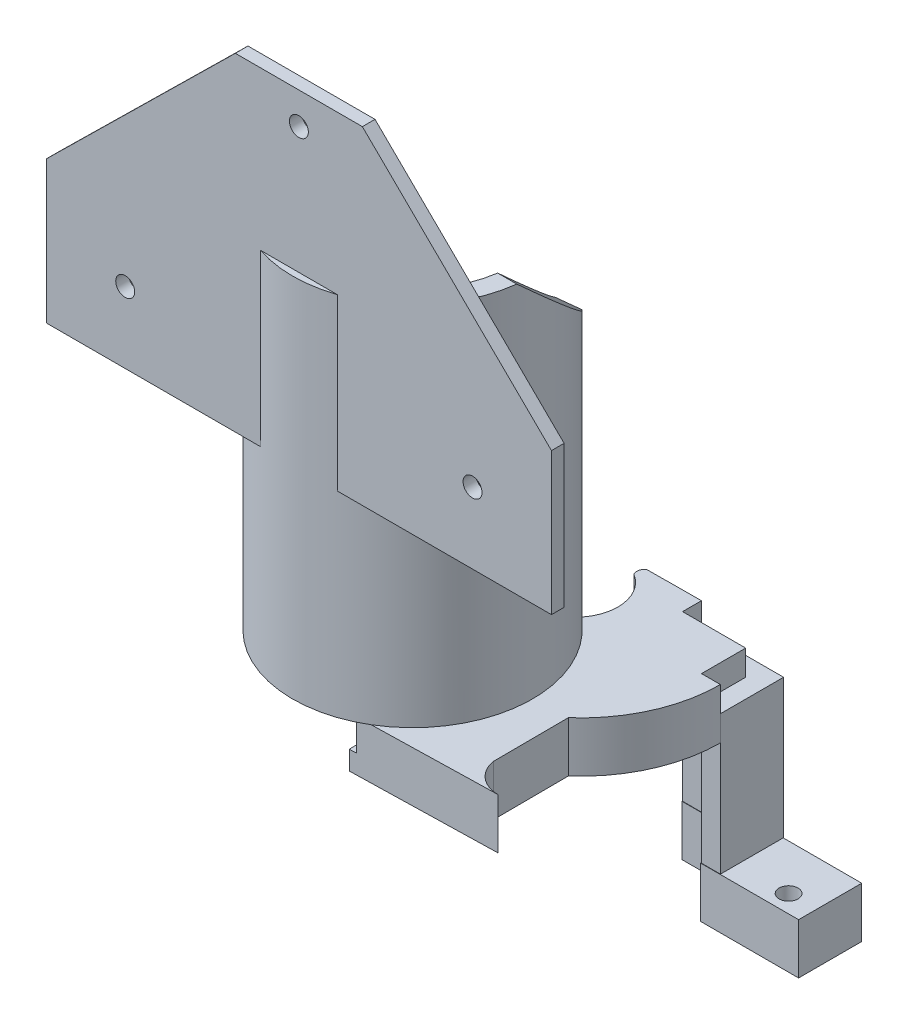
from build123d import *

# Parameters (mm, degrees)
BOSS_EXTRUDE1_DEPTH      = 53
BOSS_EXTRUDE1_DEPTH_BACK = 5
SKETCH1_R                = 19
SKETCH2_R                = 16
CUT_EXTRUDE1_DEPTH       = 22
SKETCH3_W                = 25
SKETCH3_H                = 20
CUT_EXTRUDE2_DEPTH       = 108
CUT_EXTRUDE3_DEPTH       = 108
CUT_EXTRUDE3_DEPTH_BACK  = 108
BOSS_EXTRUDE2_DEPTH      = 2
SKETCH10_R               = 1.5
CUT_EXTRUDE4_DEPTH       = 16
BOSS_EXTRUDE3_DEPTH      = 8
BOSS_EXTRUDE5_DEPTH      = 18
BOSS_EXTRUDE5_DEPTH_BACK = 4
SKETCH13_R               = 1.500172947
BOSS_EXTRUDE6_DEPTH      = 8
SKETCH16_R               = 18
CUT_EXTRUDE5_DEPTH       = 41


with BuildPart() as part:
    # Sketch1 → Boss-Extrude1 (new, two sides: drawn at the far end of the back side and taken through both)
    with BuildSketch(Plane(origin=(0, 0, 0), x_dir=(1, 0, 0), z_dir=(0, 1, 0)).offset(-BOSS_EXTRUDE1_DEPTH_BACK)):
        with Locations(Location((0, 0, 0), (0, 0, 270))):
            Circle(SKETCH1_R)
    extrude(amount=BOSS_EXTRUDE1_DEPTH + BOSS_EXTRUDE1_DEPTH_BACK)

    # Sketch2 → Cut-Extrude1 (cut)
    with BuildSketch(Plane(origin=(0, 53, 0), x_dir=(1, 0, 0), z_dir=(0, 1, 0))):
        with Locations(Location((0, 0, 0), (0, 0, 270))):
            Circle(SKETCH2_R)
    extrude(amount=-CUT_EXTRUDE1_DEPTH, mode=Mode.SUBTRACT)

    # Sketch3 → Cut-Extrude2 (cut)
    with BuildSketch(Plane(origin=(0, 53, 0), x_dir=(1, 0, 0), z_dir=(0, 1, 0))):
        with Locations((0, 16)):
            Rectangle(SKETCH3_W, SKETCH3_H)
    extrude(amount=-CUT_EXTRUDE2_DEPTH, mode=Mode.SUBTRACT)

    # Sketch7 → Cut-Extrude3 (cut, two sides: drawn at the far end of the back side and taken through both)
    with BuildSketch(Plane(origin=(0, 0, 0), x_dir=(0, 0, -1), z_dir=(1, 0, 0)).offset(-CUT_EXTRUDE3_DEPTH_BACK)):
        Polygon((14.309088021, 53), (14.309088021, 38), (-2.345455989, 53), align=None)
    extrude(amount=CUT_EXTRUDE3_DEPTH + CUT_EXTRUDE3_DEPTH_BACK, mode=Mode.SUBTRACT)

    # Sketch8 → Boss-Extrude2 (add)
    with BuildSketch(Plane.XY.offset(18)):
        Polygon((10.05709572, 78.023156751), (40, 48.571119754), (40, 26.071119754), (0, 26.071119754), (-40, 26.071119754), (-40, 48.571119754), (-10.05709572, 78.023156751), align=None)
    extrude(amount=-BOSS_EXTRUDE2_DEPTH)

    # Sketch10 → Cut-Extrude4 (cut)
    with BuildSketch(Plane(origin=(0, 0, 16), x_dir=(-1, 0, 0), z_dir=(0, 0, -1))):
        with Locations((-27.5, 37.321119754)):
            Circle(SKETCH10_R)
        with Locations((27.5, 37.321119754)):
            Circle(SKETCH10_R)
        with Locations((0, 73)):
            Circle(SKETCH10_R)
    extrude(amount=-CUT_EXTRUDE4_DEPTH, mode=Mode.SUBTRACT)

    # Sketch11 → Boss-Extrude3 (add)
    with BuildSketch(Plane.XZ.offset(5)):
        with BuildLine():
            Line((10.275891909, -26.805431868), (18.890882144, -26.863380934))
            Line((18.890882144, -26.863380934), (18.890882144, -23.863377119))
            Line((18.890882144, -23.863377119), (28.890882144, -23.863377119))
            Line((28.890882144, -23.863377119), (28.890882144, -16.863377119))
            Line((28.890882144, -16.863377119), (31.890882144, -16.863377119))
            ThreePointArc((31.890882144, -16.863377119), (29.928759086, -7.76088478), (24.390882144, -0.275084044))
            Line((24.390882144, -0.275084044), (24.452405581, 11.618795847))
            ThreePointArc((24.452405581, 11.618795847), (26.143620347, 14.638664645), (29.390882144, 15.836623644))
            Line((29.390882144, 15.836623644), (6.375618396, 16.386397999))
            Line((6.375618396, 16.386397999), (6.012446141, 1.182878311))
            Line((6.012446141, 1.182878311), (6.390882144, -8.863379027))
            Line((6.390882144, -8.863379027), (6.480237612, -11.760990645))
            ThreePointArc((6.480237612, -11.760990645), (7.33967567, -12.860163004), (8.724622378, -13.029680754))
            ThreePointArc((8.724622378, -13.029680754), (13.107641391, -18.70255332), (9.931897769, -25.129604841))
            ThreePointArc((9.931897769, -25.129604841), (9.756819698, -26.038761874), (10.275891909, -26.805431868))
        make_face()
    extrude(amount=BOSS_EXTRUDE3_DEPTH)

    # Sketch16 → Cut-Extrude5 (cut)
    with BuildSketch(Plane(origin=(0, 31, 0), x_dir=(1, 0, 0), z_dir=(0, 1, 0))):
        Circle(SKETCH16_R)
    extrude(amount=-CUT_EXTRUDE5_DEPTH, mode=Mode.SUBTRACT)


with BuildPart() as body_2:
    # Sketch12 → Boss-Extrude5 (new, two sides: drawn at the far end of the back side and taken through both)
    with BuildSketch(Plane.XZ.offset(13).offset(-BOSS_EXTRUDE5_DEPTH_BACK)):
        Polygon((18.890882144, -26.863380934), (18.890882144, -23.863377119), (28.890882144, -23.863377119), (28.890882144, -16.863377119), (31.890882144, -16.863377119), (31.890882144, -26.863380934), align=None)
    extrude(amount=BOSS_EXTRUDE5_DEPTH + BOSS_EXTRUDE5_DEPTH_BACK)

    # Sketch13 → Boss-Extrude6 (add)
    with BuildSketch(Plane.XZ.offset(31)):
        Polygon((18.822698898, -26.807587047), (18.822698898, -23.807583233), (28.822698898, -23.807583233), (28.822698898, -16.807583233), (44.322698898, -16.807583233), (44.322698898, -26.807587047), align=None)
        with Locations(Location((39.936045011, -19.607691517, 0), (0, 0, 270))):
            Circle(SKETCH13_R, mode=Mode.SUBTRACT)
    extrude(amount=BOSS_EXTRUDE6_DEPTH)


solid = Compound([part.part, body_2.part])
